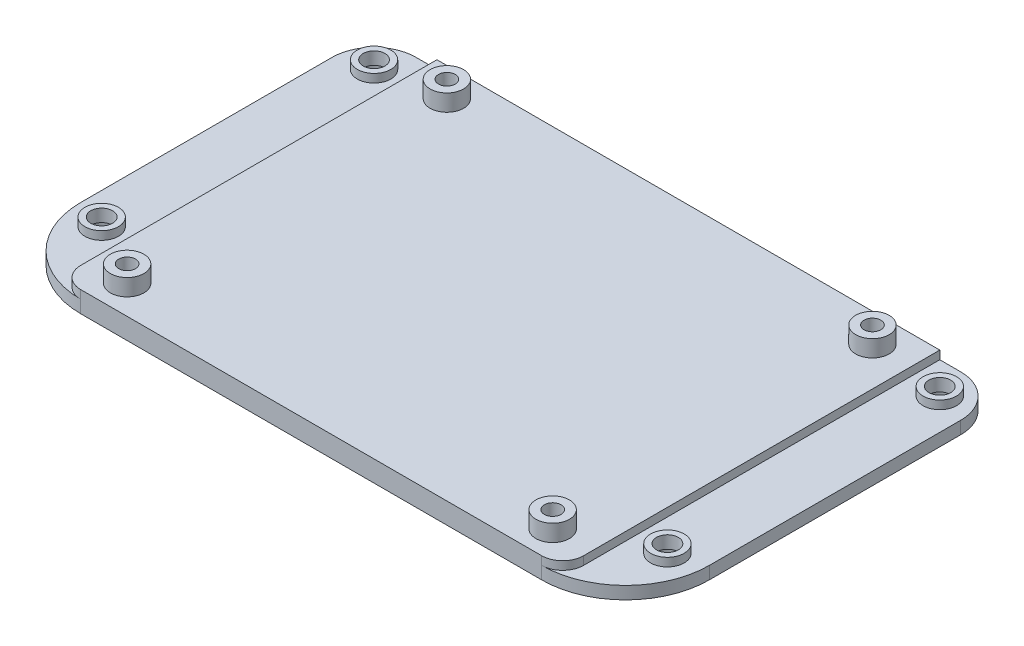
from build123d import *

# Parameters (mm, degrees)
SKETCH1_W           = 120
SKETCH1_H           = 90
BOSS_EXTRUDE1_DEPTH = 2
SKETCH2_R           = 4
SKETCH2_R_2         = 2
BOSS_EXTRUDE2_DEPTH = 4
FILLET1_R           = 5
BOSS_EXTRUDE3_DEPTH = 3
SKETCH4_R           = 4.5
CUT_EXTRUDE1_DEPTH  = 2
SKETCH5_R           = 4
SKETCH5_R_2         = 2.6
BOSS_EXTRUDE4_DEPTH = 2
SKETCH6_R           = 2.6
CUT_EXTRUDE2_DEPTH  = 163.360709533
CUT_EXTRUDE3_START  = -6.7
SKETCH7_R           = 2
CUT_EXTRUDE3_DEPTH  = 6.7


with BuildPart() as part:
    # Sketch1 → Boss-Extrude1 (new body)
    with BuildSketch(Plane(origin=(0, 0, 0), x_dir=(1, 0, 0), z_dir=(0, 1, 0))):
        with Locations((60, 45)):
            Rectangle(SKETCH1_W, SKETCH1_H)
    extrude(amount=BOSS_EXTRUDE1_DEPTH)

    # Sketch2 → Boss-Extrude2 (add)
    # profile 1 of 4: a face of its own
    with BuildSketch(Plane(origin=(0, 2, 0), x_dir=(1, 0, 0), z_dir=(0, 1, 0))):
        with Locations(Location((9.225, 83.15, 0), (0, 0, 90))):
            Circle(SKETCH2_R)
        with Locations(Location((9.225, 83.15, 0), (0, 0, 270))):
            Circle(SKETCH2_R_2, mode=Mode.SUBTRACT)
    # profile 2 of 4: a face of its own
    with BuildSketch(Plane(origin=(0, 2, 0), x_dir=(1, 0, 0), z_dir=(0, 1, 0))):
        with Locations(Location((9.225, 6.85, 0), (0, 0, 90))):
            Circle(SKETCH2_R)
        with Locations(Location((9.225, 6.85, 0), (0, 0, 270))):
            Circle(SKETCH2_R_2, mode=Mode.SUBTRACT)
    # profile 3 of 4: a face of its own
    with BuildSketch(Plane(origin=(0, 2, 0), x_dir=(1, 0, 0), z_dir=(0, 1, 0))):
        with Locations(Location((110.775, 83.15, 0), (0, 0, 90))):
            Circle(SKETCH2_R)
        with Locations(Location((110.775, 83.15, 0), (0, 0, 270))):
            Circle(SKETCH2_R_2, mode=Mode.SUBTRACT)
    # profile 4 of 4: a face of its own
    with BuildSketch(Plane(origin=(0, 2, 0), x_dir=(1, 0, 0), z_dir=(0, 1, 0))):
        with Locations(Location((110.775, 6.85, 0), (0, 0, 90))):
            Circle(SKETCH2_R)
        with Locations(Location((110.775, 6.85, 0), (0, 0, 270))):
            Circle(SKETCH2_R_2, mode=Mode.SUBTRACT)
    extrude(amount=BOSS_EXTRUDE2_DEPTH)

    # Fillet1
    fillet1_edges = [part.edges().sort_by_distance(p)[0] for p in [
        (120, 1, 0),
        (0, 1, 0),
    ]]
    fillet(fillet1_edges, radius=FILLET1_R)

    # Sketch3 → Boss-Extrude3 (add)
    with BuildSketch(Plane.XZ):
        with BuildLine():
            Line((5, 0), (115, 0))
            ThreePointArc((115, 0), (129.142135624, -5.857864376), (135, -20))
            Line((135, -20), (135, -80))
            ThreePointArc((135, -80), (132.071067812, -87.071067812), (125, -90))
            Line((125, -90), (-5, -90))
            ThreePointArc((-5, -90), (-12.071067812, -87.071067812), (-15, -80))
            Line((-15, -80), (-15, -20))
            ThreePointArc((-15, -20), (-9.142135624, -5.857864376), (5, 0))
        make_face()
    extrude(amount=BOSS_EXTRUDE3_DEPTH)

    # Sketch4 → Cut-Extrude1 (cut)
    with BuildSketch(Plane.XZ.offset(3)):
        with Locations(Location((-7.5, -17.5, 0), (0, 0, 270))):
            Circle(SKETCH4_R)
        with Locations(Location((-7.5, -82.5, 0), (0, 0, 270))):
            Circle(SKETCH4_R)
        with Locations(Location((127.5, -17.5, 0), (0, 0, 270))):
            Circle(SKETCH4_R)
        with Locations(Location((127.5, -82.5, 0), (0, 0, 270))):
            Circle(SKETCH4_R)
    extrude(amount=-CUT_EXTRUDE1_DEPTH, mode=Mode.SUBTRACT)

    # Sketch5 → Boss-Extrude4 (add)
    # profile 1 of 4: a face of its own
    with BuildSketch(Plane(origin=(0, 0, 0), x_dir=(1, 0, 0), z_dir=(0, 1, 0))):
        with Locations(Location((-7.5, 17.5, 0), (0, 0, 270))):
            Circle(SKETCH5_R)
        with Locations(Location((-7.5, 17.5, 0), (0, 0, 270))):
            Circle(SKETCH5_R_2, mode=Mode.SUBTRACT)
    # profile 2 of 4: a face of its own
    with BuildSketch(Plane(origin=(0, 0, 0), x_dir=(1, 0, 0), z_dir=(0, 1, 0))):
        with Locations(Location((127.5, 17.5, 0), (0, 0, 270))):
            Circle(SKETCH5_R)
        with Locations(Location((127.5, 17.5, 0), (0, 0, 270))):
            Circle(SKETCH5_R_2, mode=Mode.SUBTRACT)
    # profile 3 of 4: a face of its own
    with BuildSketch(Plane(origin=(0, 0, 0), x_dir=(1, 0, 0), z_dir=(0, 1, 0))):
        with Locations(Location((127.5, 82.5, 0), (0, 0, 270))):
            Circle(SKETCH5_R)
        with Locations(Location((127.5, 82.5, 0), (0, 0, 270))):
            Circle(SKETCH5_R_2, mode=Mode.SUBTRACT)
    # profile 4 of 4: a face of its own
    with BuildSketch(Plane(origin=(0, 0, 0), x_dir=(1, 0, 0), z_dir=(0, 1, 0))):
        with Locations(Location((-7.5, 82.5, 0), (0, 0, 270))):
            Circle(SKETCH5_R)
        with Locations(Location((-7.5, 82.5, 0), (0, 0, 270))):
            Circle(SKETCH5_R_2, mode=Mode.SUBTRACT)
    extrude(amount=BOSS_EXTRUDE4_DEPTH)

    # Sketch6 → Cut-Extrude2 (cut, through all)
    with BuildSketch(Plane(origin=(0, 0, 0), x_dir=(1, 0, 0), z_dir=(0, 1, 0))):
        with Locations(Location((-7.5, 17.5, 0), (0, 0, 90))):
            Circle(SKETCH6_R)
        with Locations(Location((127.5, 17.5, 0), (0, 0, 90))):
            Circle(SKETCH6_R)
        with Locations(Location((127.5, 82.5, 0), (0, 0, 90))):
            Circle(SKETCH6_R)
        with Locations(Location((-7.5, 82.5, 0), (0, 0, 90))):
            Circle(SKETCH6_R)
    extrude(amount=-CUT_EXTRUDE2_DEPTH, mode=Mode.SUBTRACT)

    # Sketch7 → Cut-Extrude3 (cut)
    with BuildSketch(Plane(origin=(0, 6, 0), x_dir=(1, 0, 0), z_dir=(0, 1, 0)).offset(CUT_EXTRUDE3_START)):
        with Locations(Location((110.775, 83.15, 0), (0, 0, 270))):
            Circle(SKETCH7_R)
        with Locations(Location((110.775, 6.85, 0), (0, 0, 270))):
            Circle(SKETCH7_R)
        with Locations(Location((9.225, 6.85, 0), (0, 0, 270))):
            Circle(SKETCH7_R)
        with Locations(Location((9.225, 83.15, 0), (0, 0, 270))):
            Circle(SKETCH7_R)
    extrude(amount=CUT_EXTRUDE3_DEPTH, mode=Mode.SUBTRACT)


solid = part.part
